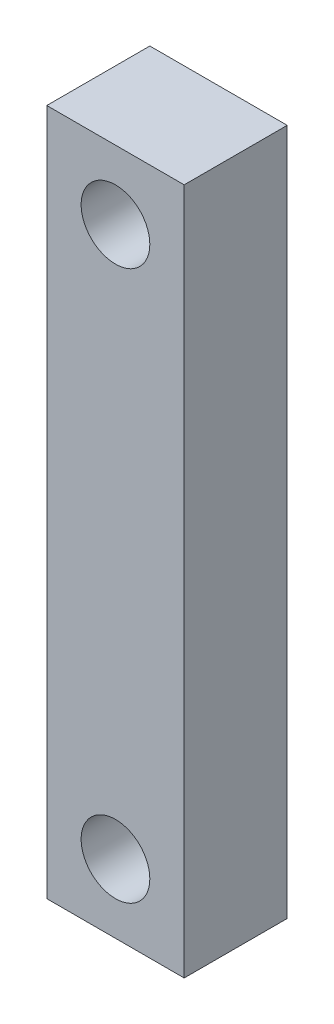
from build123d import *

# Parameters (mm, degrees)
SKETCH1_W           = 20
SKETCH1_H           = 100
BOSS_EXTRUDE1_DEPTH = 15
SKETCH2_R           = 5
CUT_EXTRUDE1_DEPTH  = 15


with BuildPart() as part:
    # Sketch1 → Boss-Extrude1 (new body)
    with BuildSketch(Plane.XY):
        Rectangle(SKETCH1_W, SKETCH1_H)
    extrude(amount=BOSS_EXTRUDE1_DEPTH)

    # Sketch2 → Cut-Extrude1 (cut)
    with BuildSketch(Plane.XY.offset(15)):
        with Locations((0, 40)):
            Circle(SKETCH2_R)
        with Locations((0, -40)):
            Circle(SKETCH2_R)
    extrude(amount=-CUT_EXTRUDE1_DEPTH, mode=Mode.SUBTRACT)


solid = part.part
